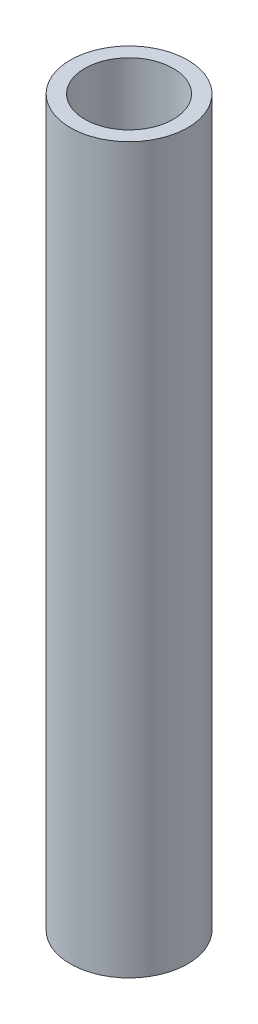
from build123d import *

# Parameters (mm, degrees)
SZKIC1_R                    = 16.85
SZKIC1_R_2                  = 12.7
DODANIE_WYCI_GNI_CIE1_DEPTH = 208


with BuildPart() as part:
    # Szkic1 → Dodanie-wyciągnięcie1 (new body)
    with BuildSketch(Plane(origin=(0, 0, 0), x_dir=(1, 0, 0), z_dir=(0, 1, 0))):
        with Locations(Location((0, 0, 0), (0, 0, 90))):
            Circle(SZKIC1_R)
        with Locations(Location((0, 0, 0), (0, 0, 90))):
            Circle(SZKIC1_R_2, mode=Mode.SUBTRACT)
    extrude(amount=DODANIE_WYCI_GNI_CIE1_DEPTH)


solid = part.part
